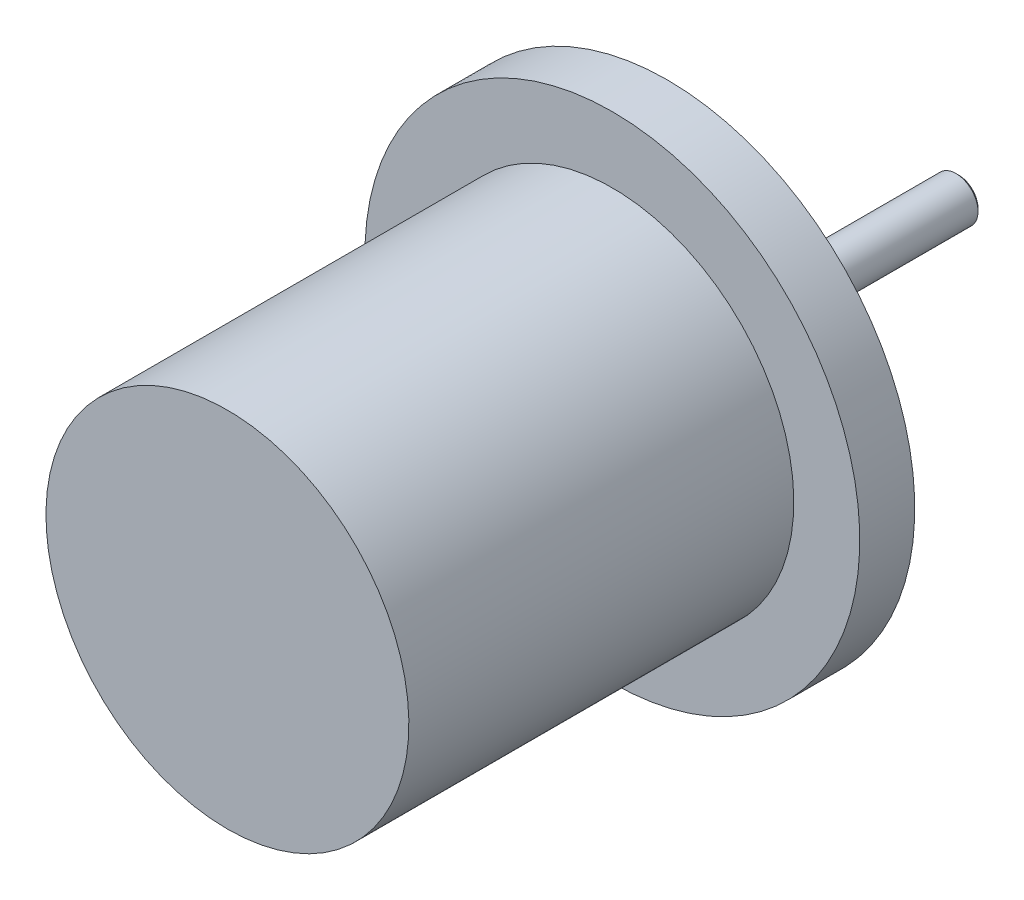
from build123d import *

# Parameters (mm, degrees)
CUT_EXTRUDE1_DEPTH = 2.5
CHAMFER1_SIZE      = 0.5
SKETCH7_R          = 3
CUT_EXTRUDE4_DEPTH = 3
SKETCH8_R          = 1.5
CUT_EXTRUDE5_DEPTH = 5
CHAMFER2_SIZE      = 0.5


with BuildPart() as part:
    # Sketch1 → Revolve1 (revolve)
    with BuildSketch(Plane(origin=(0, 0, 0), x_dir=(0, 0, -1), z_dir=(1, 0, 0)), mode=Mode.PRIVATE) as revolve1_sk:
        Polygon((-67.783857366, 0), (65.216142634, 0), (65.216142634, 4), (31.216142634, 4), (31.216142634, 6), (15.216142634, 6), (15.216142634, 17.5), (12.216142634, 17.5), (12.216142634, 45), (2.216142634, 45), (2.216142634, 33), (-67.783857366, 33), align=None)
    revolve(revolve1_sk.sketch.rotate(Axis((0, 0, 67.783857366), (0, 0, -1)), 180), axis=Axis((0, 0, 67.783857366), (0, 0, -1)))

    # Sketch2 → Cut-Extrude1 (cut)
    with BuildSketch(Plane(origin=(0, 6, 0), x_dir=(1, 0, 0), z_dir=(0, 1, 0))):
        with BuildLine():
            Line((-2.025, 20.732267436), (-2.025, 27.682267436))
            ThreePointArc((-2.025, 27.682267436), (0, 29.707267436), (2.025, 27.682267436))
            Line((2.025, 27.682267436), (2.025, 20.732267436))
            ThreePointArc((2.025, 20.732267436), (0, 18.707267436), (-2.025, 20.732267436))
        make_face()
    extrude(amount=-CUT_EXTRUDE1_DEPTH, mode=Mode.SUBTRACT)

    # Chamfer1
    chamfer1_edges = [part.edges().sort_by_distance(p)[0] for p in [
        (0, 6, -31.216142634),
    ]]
    chamfer(chamfer1_edges, length=CHAMFER1_SIZE)

    # Sketch7 → Cut-Extrude4 (cut)
    with BuildSketch(Plane(origin=(0, 0, -12.216142634), x_dir=(-1, 0, 0), z_dir=(0, 0, -1))):
        with Locations(Location((0, 35, 0), (0, 0, 90))):
            Circle(SKETCH7_R)
        with Locations(Location((24.748737342, 24.748737342, 0), (0, 0, 90))):
            Circle(SKETCH7_R)
        with Locations(Location((35, 0, 0), (0, 0, 90))):
            Circle(SKETCH7_R)
        with Locations(Location((24.748737342, -24.748737342, 0), (0, 0, 90))):
            Circle(SKETCH7_R)
        with Locations(Location((0, -35, 0), (0, 0, 90))):
            Circle(SKETCH7_R)
        with Locations(Location((-24.748737342, -24.748737342, 0), (0, 0, 90))):
            Circle(SKETCH7_R)
        with Locations(Location((-35, 0, 0), (0, 0, 90))):
            Circle(SKETCH7_R)
        with Locations(Location((-24.748737342, 24.748737342, 0), (0, 0, 90))):
            Circle(SKETCH7_R)
    extrude(amount=-CUT_EXTRUDE4_DEPTH, mode=Mode.SUBTRACT)

    # Sketch8 → Cut-Extrude5 (cut)
    with BuildSketch(Plane(origin=(0, 0, -65.216142634), x_dir=(-1, 0, 0), z_dir=(0, 0, -1))):
        with Locations(Location((0, 0, 0), (0, 0, 90))):
            Circle(SKETCH8_R)
    extrude(amount=-CUT_EXTRUDE5_DEPTH, mode=Mode.SUBTRACT)

    # Chamfer2
    chamfer2_edges = [part.edges().sort_by_distance(p)[0] for p in [
        (0, 4, -65.216142634),
    ]]
    chamfer(chamfer2_edges, length=CHAMFER2_SIZE)


solid = part.part
